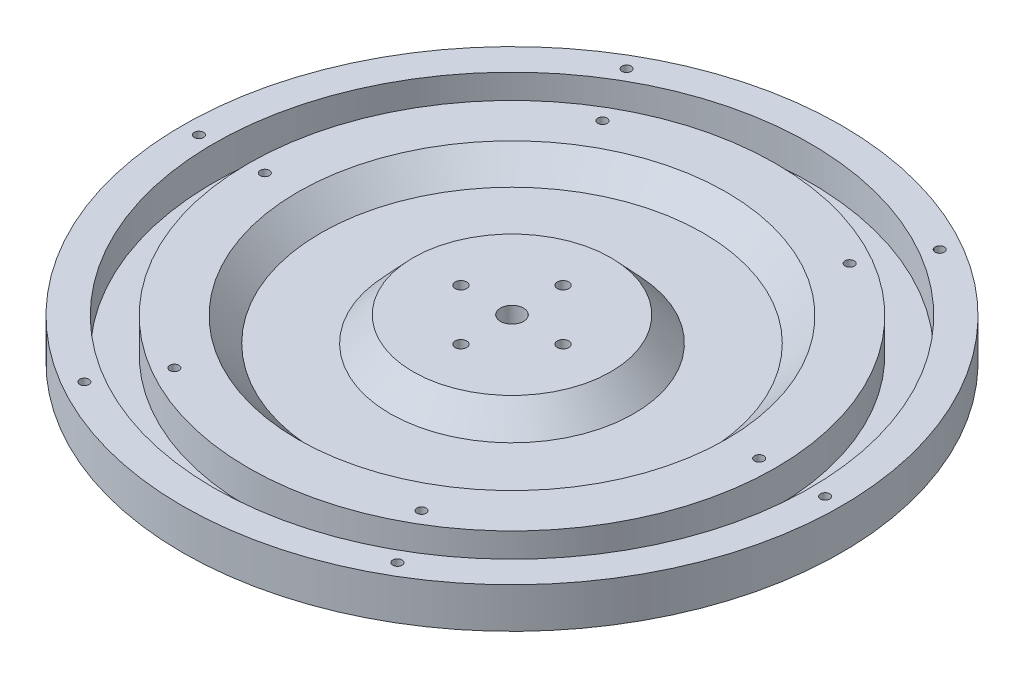
from build123d import *

# Parameters (mm, degrees)
KES_EKSTR_ZYON3_DEPTH      = 142.972708645
KES_EKSTR_ZYON3_DEPTH_BACK = 142.972708645
IZIM3_R                    = 3.5
IZIM3_R_2                  = 1.75
IZIM4_R                    = 1.4
KES_EKSTR_ZYON4_DEPTH      = 142.972708645
DAIRESEL_KAPLAMA1_COUNT    = 6


with BuildPart() as part:
    # Çizim2 → Döndür1 (revolve)
    with BuildSketch(Plane(origin=(0, 0, 0), x_dir=(0, 0, -1), z_dir=(1, 0, 0))):
        Polygon((0, 0), (-100, 0), (-100, 12.25), (-90.5, 12.25), (-90.5, 2), (-80, 2), (-80, 12.25), (-65, 12.25), (-58, 5), (-37, 5), (-30, 12.5), (0, 12.5), align=None)
    revolve(axis=Axis((0, 27.631034793, 0), (0, -1, 0)))

    # Çizim3 → Kes-Ekstrüzyon3 (cut, two sides: drawn at the far end of the back side and taken through both)
    with BuildSketch(Plane(origin=(0, 12.5, 0), x_dir=(1, 0, 0), z_dir=(0, 1, 0)).offset(-KES_EKSTR_ZYON3_DEPTH_BACK)):
        with Locations(Location((0, 0, 0), (0, 0, 270))):
            Circle(IZIM3_R)
        with Locations(Location((-15.5, 0, 0), (0, 0, 270))):
            Circle(IZIM3_R_2)
        with Locations(Location((0, -15.5, 0), (0, 0, 270))):
            Circle(IZIM3_R_2)
        with Locations(Location((0, 15.5, 0), (0, 0, 270))):
            Circle(IZIM3_R_2)
        with Locations(Location((15.5, 0, 0), (0, 0, 270))):
            Circle(IZIM3_R_2)
    extrude(amount=KES_EKSTR_ZYON3_DEPTH + KES_EKSTR_ZYON3_DEPTH_BACK, mode=Mode.SUBTRACT)

    # Çizim4 → Kes-Ekstrüzyon4 (cut, symmetric)
    with BuildSketch(Plane(origin=(0, 12.5, 0), x_dir=(1, 0, 0), z_dir=(0, 1, 0))):
        with Locations(Location((-75, 0, 0), (0, 0, 270))):
            Circle(IZIM4_R)
        with Locations(Location((-95, 0, 0), (0, 0, 270))):
            Circle(IZIM4_R)
    kes_ekstr_zyon4 = extrude(amount=KES_EKSTR_ZYON4_DEPTH, both=True, mode=Mode.SUBTRACT)

    # Dairesel Kaplama1: Kes-Ekstrüzyon4 ×6 about axis
    dairesel_kaplama1_axis = Axis((0, 0, 0), (0, 1, 0))
    for i in range(1, DAIRESEL_KAPLAMA1_COUNT):
        add(kes_ekstr_zyon4.rotate(dairesel_kaplama1_axis, i * 360 / DAIRESEL_KAPLAMA1_COUNT), mode=Mode.SUBTRACT)


solid = part.part
